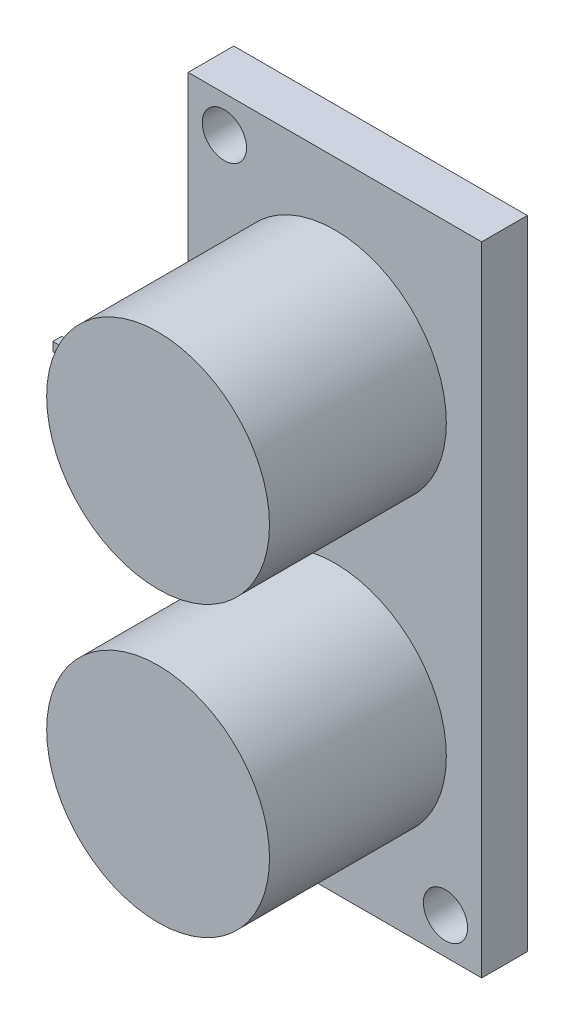
from build123d import *

# Parameters (mm, degrees)
SKETCH1_W           = 45.7835
SKETCH1_H           = 21.082
SKETCH1_R           = 1.5875
BOSS_EXTRUDE1_DEPTH = 3.2766
SKETCH2_R           = 8.001
BOSS_EXTRUDE2_DEPTH = 12.7
SKETCH3_W           = 2.54
SKETCH3_H           = 7.62
BOSS_EXTRUDE3_DEPTH = 2.54
SKETCH4_W           = 0.635
SKETCH4_H           = 0.635
BOSS_EXTRUDE4_DEPTH = 6.35


with BuildPart() as part:
    # Sketch1 → Boss-Extrude1 (new body)
    with BuildSketch(Plane(origin=(0, 0, 0), x_dir=(0, 1, 0), z_dir=(0, 0, 1))):
        Rectangle(SKETCH1_W, SKETCH1_H)
        with Locations(Location((-20.28825, -7.9375, 0), (0, 0, 90))):
            Circle(SKETCH1_R, mode=Mode.SUBTRACT)
        with Locations(Location((20.28825, 7.9375, 0), (0, 0, 90))):
            Circle(SKETCH1_R, mode=Mode.SUBTRACT)
    extrude(amount=BOSS_EXTRUDE1_DEPTH)

    # Sketch2 → Boss-Extrude2 (add)
    with BuildSketch(Plane.XY.offset(3.2766)):
        with Locations((0, 10.362469871)):
            Circle(SKETCH2_R)
        with Locations((0, -10.362469871)):
            Circle(SKETCH2_R)
    extrude(amount=BOSS_EXTRUDE2_DEPTH)

    # Sketch3 → Boss-Extrude3 (add)
    with BuildSketch(Plane.XY.offset(3.2766)):
        with Locations((-11.049, 0.03175)):
            Rectangle(SKETCH3_W, SKETCH3_H)
    extrude(amount=BOSS_EXTRUDE3_DEPTH)

    # Sketch4 → Boss-Extrude4 (add)
    with BuildSketch(Plane(origin=(-12.319, 0, 0), x_dir=(0, -1, 0), z_dir=(-1, 0, 0))):
        with Locations((2.50825, 4.5466)):
            Rectangle(SKETCH4_W, SKETCH4_H)
        with Locations((-0.03175, 4.5466)):
            Rectangle(SKETCH4_W, SKETCH4_H)
        with Locations((-2.57175, 4.5466)):
            Rectangle(SKETCH4_W, SKETCH4_H)
    extrude(amount=BOSS_EXTRUDE4_DEPTH)


solid = part.part
